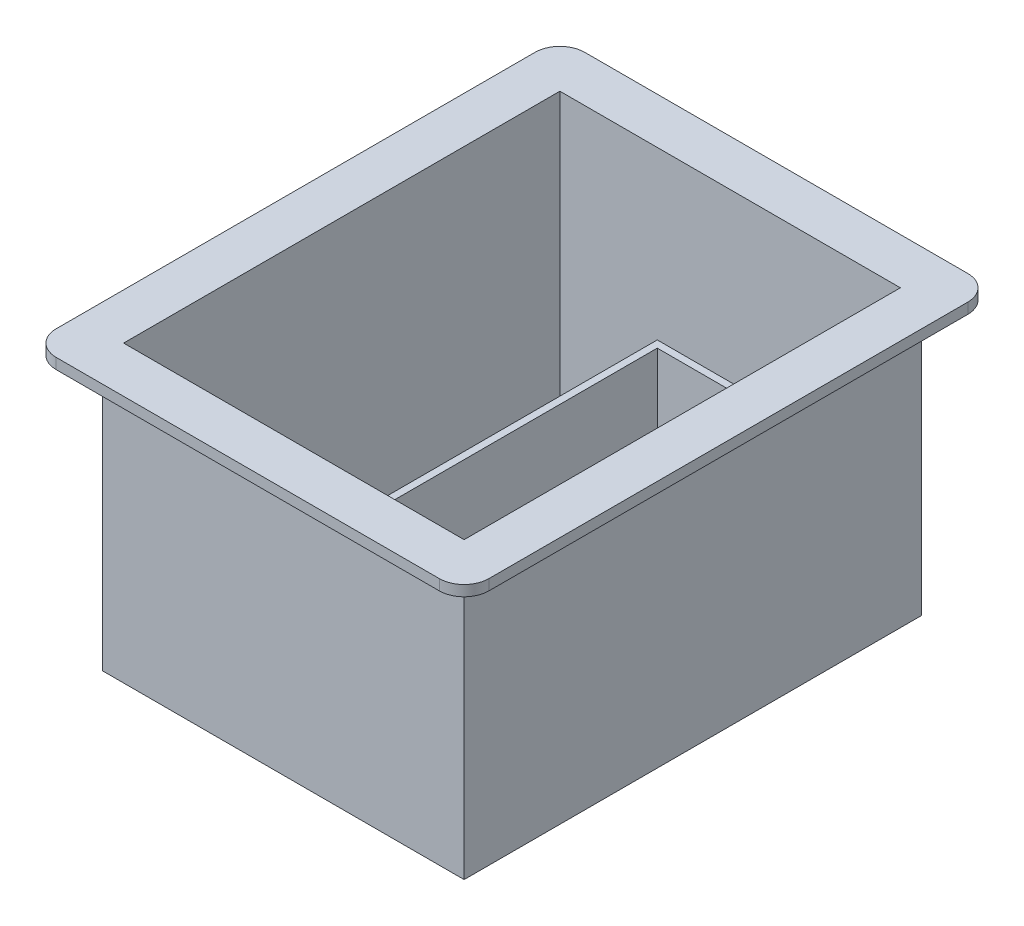
from build123d import *

# Parameters (mm, degrees)
SKETCH1_W           = 102
SKETCH1_H           = 129
BOSS_EXTRUDE1_DEPTH = 77
SKETCH2_W           = 122
SKETCH2_H           = 149
BOSS_EXTRUDE2_DEPTH = 3
SKETCH3_W           = 96
SKETCH3_H           = 123
CUT_EXTRUDE1_DEPTH  = 77
SKETCH4_W           = 64
SKETCH4_H           = 89
SKETCH4_W_2         = 62
SKETCH4_H_2         = 34
BOSS_EXTRUDE3_DEPTH = 30
SKETCH5_W           = 60
SKETCH5_H           = 83.431405536
SKETCH5_H_2         = 32
CUT_EXTRUDE2_DEPTH  = 30
FILLET1_R           = 7


with BuildPart() as part:
    # Sketch1 → Boss-Extrude1 (new body)
    with BuildSketch(Plane(origin=(0, 0, 0), x_dir=(1, 0, 0), z_dir=(0, 1, 0))):
        with Locations((51, 64.5)):
            Rectangle(SKETCH1_W, SKETCH1_H)
    extrude(amount=BOSS_EXTRUDE1_DEPTH)

    # Sketch2 → Boss-Extrude2 (add)
    with BuildSketch(Plane(origin=(0, 77, 0), x_dir=(1, 0, 0), z_dir=(0, 1, 0))):
        with Locations((51, 64.5)):
            Rectangle(SKETCH2_W, SKETCH2_H)
    extrude(amount=BOSS_EXTRUDE2_DEPTH)

    # Sketch3 → Cut-Extrude1 (cut)
    with BuildSketch(Plane(origin=(0, 80, 0), x_dir=(1, 0, 0), z_dir=(0, 1, 0))):
        with Locations((51, 64.5)):
            Rectangle(SKETCH3_W, SKETCH3_H)
    extrude(amount=-CUT_EXTRUDE1_DEPTH, mode=Mode.SUBTRACT)

    # Sketch4 → Boss-Extrude3 (add)
    with BuildSketch(Plane(origin=(0, 3, 0), x_dir=(1, 0, 0), z_dir=(0, 1, 0))):
        with Locations((62.459815843, 83.068594464)):
            Rectangle(SKETCH4_W, SKETCH4_H)
        with Locations((34, 20)):
            Rectangle(SKETCH4_W_2, SKETCH4_H_2)
    extrude(amount=BOSS_EXTRUDE3_DEPTH)

    # Sketch5 → Cut-Extrude2 (cut)
    with BuildSketch(Plane(origin=(0, 33, 0), x_dir=(1, 0, 0), z_dir=(0, 1, 0))):
        with Locations((62.459815843, 82.284297232)):
            Rectangle(SKETCH5_W, SKETCH5_H)
        with Locations((33, 19)):
            Rectangle(SKETCH5_W, SKETCH5_H_2)
    extrude(amount=-CUT_EXTRUDE2_DEPTH, mode=Mode.SUBTRACT)

    # Fillet1
    fillet1_edges = [part.edges().sort_by_distance(p)[0] for p in [
        (-10, 78.5, -139),
        (-10, 78.5, 10),
        (112, 78.5, 10),
        (112, 78.5, -139),
    ]]
    fillet(fillet1_edges, radius=FILLET1_R)


solid = part.part
